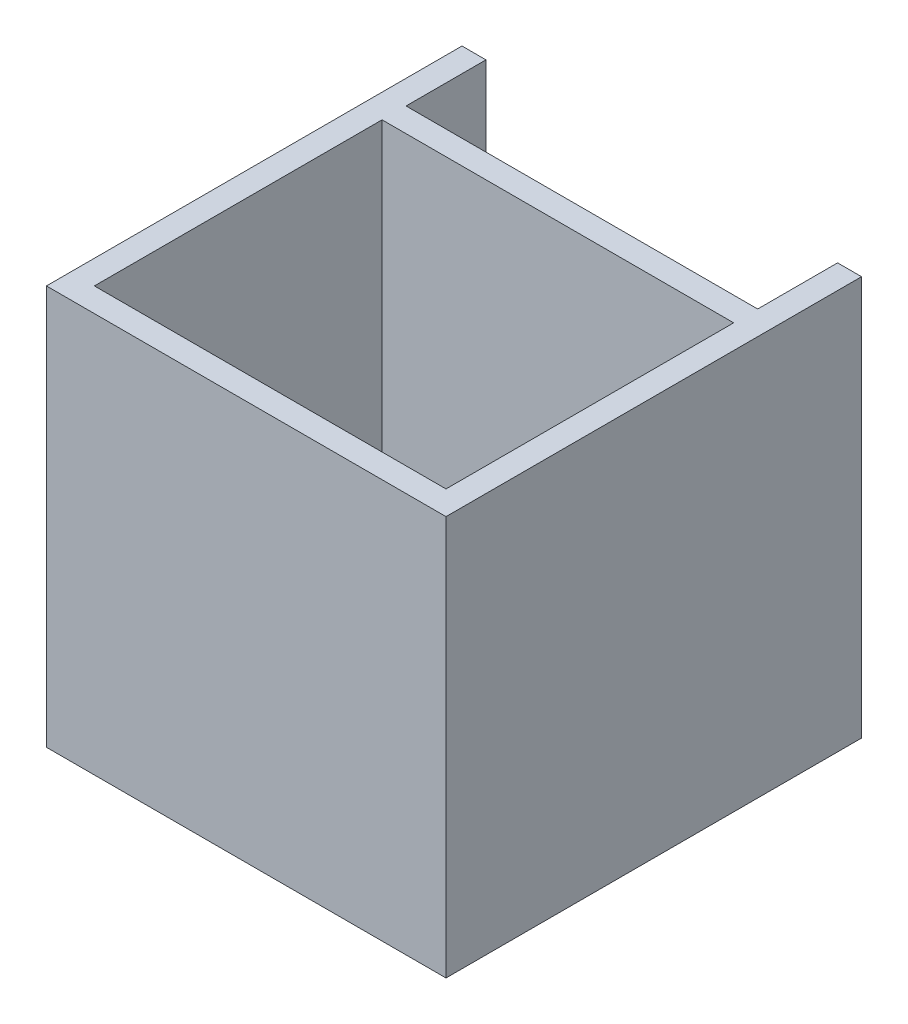
from build123d import *

# Parameters (mm, degrees)
EXTRUDE_1_DEPTH = 25


with BuildPart() as part:
    # Эскиз1 → Бобышка-Вытянуть1 (new body)
    with BuildSketch(Plane(origin=(0, 0, 0), x_dir=(1, 0, 0), z_dir=(0, 1, 0))):
        Polygon((11, 8), (-11, 8), (-11, 13), (-12.5, 13), (-12.5, 6), (-12.5, -11), (-12.5, -11.5), (-12.5, -13), (-11, -13), (11, -13), (12.5, -13), (12.5, -11.5), (12.5, 6), (12.5, 6.5), (12.5, 8), (12.5, 13), (11, 13), align=None)
        Polygon((-11, 6.5), (11, 6.5), (11, 6), (11, -11), (11, -11.5), (-11, -11.5), (-11, -11), (-11, 6), align=None, mode=Mode.SUBTRACT)
    extrude(amount=EXTRUDE_1_DEPTH)


solid = part.part
